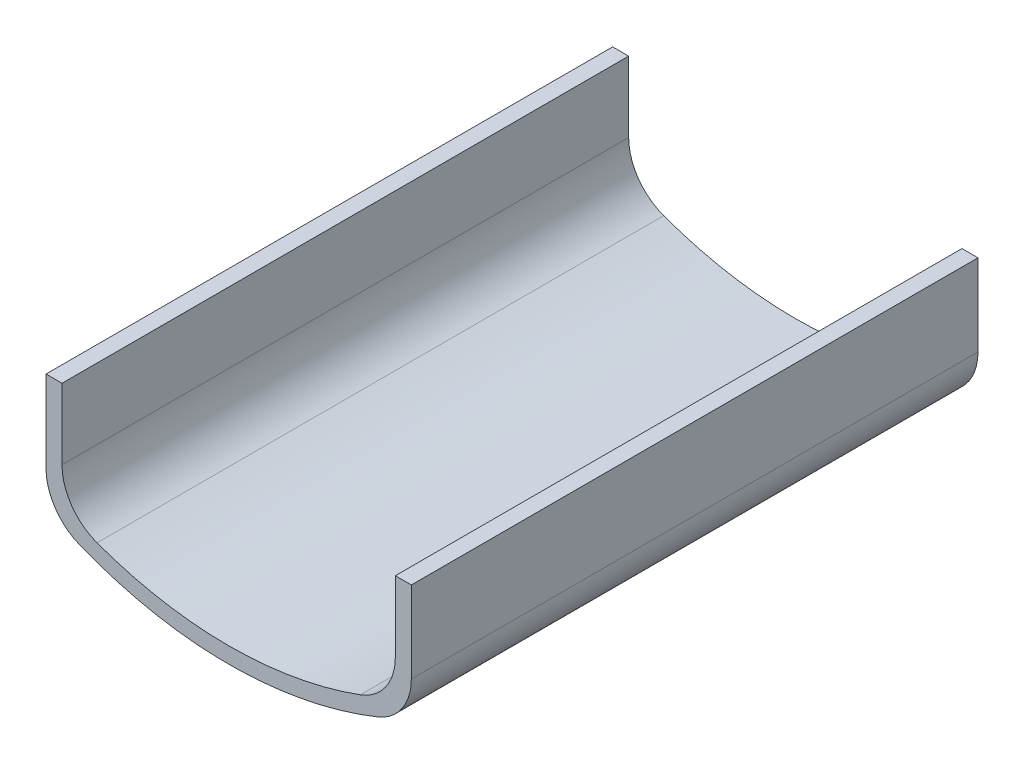
from build123d import *

# Parameters (mm, degrees)
BOSS_EXTRUDE1_DEPTH = 26.9875


with BuildPart() as part:
    # Sketch3 → Boss-Extrude1 (new body)
    with BuildSketch(Plane.XY):
        with BuildLine():
            Line((7.9375, 5.04103367), (7.9375, 1.680064545))
            ThreePointArc((7.9375, 1.680064545), (7.47924218, 0.224746884), (6.269823232, -0.705444243))
            ThreePointArc((6.269823232, -0.705444243), (0, -1.815849828), (-6.269823232, -0.705444243))
            ThreePointArc((-6.269823232, -0.705444243), (-7.47924218, 0.224746884), (-7.9375, 1.680064545))
            Line((-7.9375, 1.680064545), (-7.9375, 5.04103367))
            Line((-7.9375, 5.04103367), (-8.6995, 5.04103367))
            Line((-8.6995, 5.04103367), (-8.6995, 1.15664138))
            ThreePointArc((-8.6995, 1.15664138), (-8.264634287, -0.26462905), (-7.108941233, -1.199236661))
            ThreePointArc((-7.108941233, -1.199236661), (0, -2.577849828), (7.108941233, -1.199236661))
            ThreePointArc((7.108941233, -1.199236661), (8.264634287, -0.26462905), (8.6995, 1.15664138))
            Line((8.6995, 1.15664138), (8.6995, 5.04103367))
            Line((8.6995, 5.04103367), (7.9375, 5.04103367))
        make_face()
    extrude(amount=BOSS_EXTRUDE1_DEPTH)


solid = part.part
